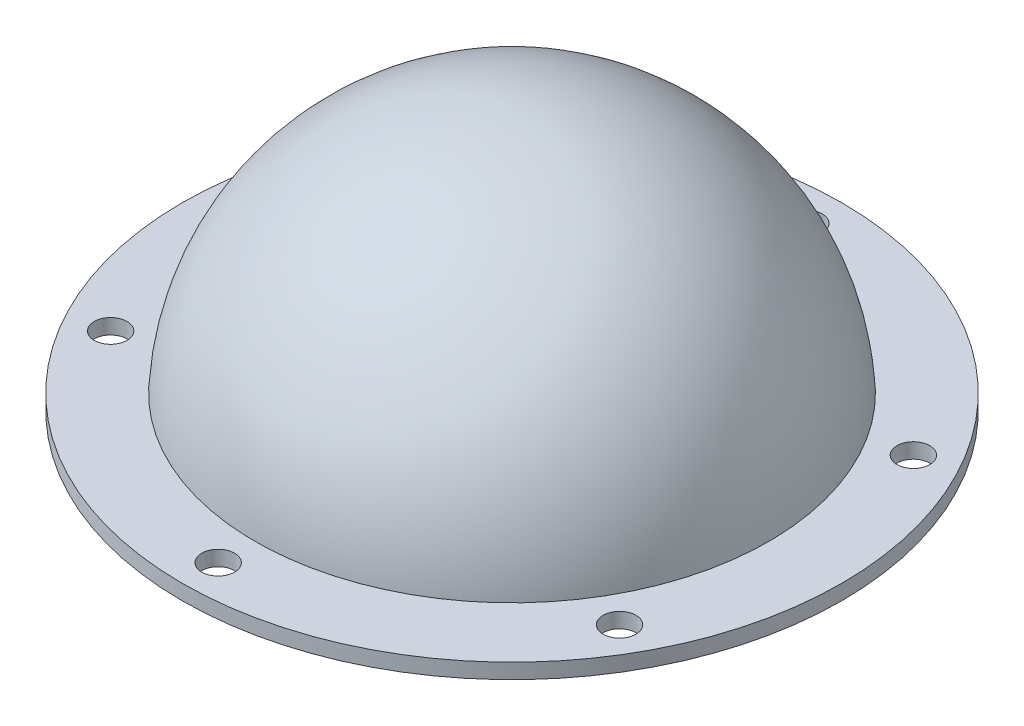
from build123d import *

# Parameters (mm, degrees)
SKETCH2_R          = 2.15
CUT_EXTRUDE1_DEPTH = 10


with BuildPart() as part:
    # Sketch1 → Revolve1 (revolve)
    with BuildSketch(Plane(origin=(0, 0, 0), x_dir=(0, 0, -1), z_dir=(1, 0, 0)), mode=Mode.PRIVATE) as revolve1_sk:
        with BuildLine():
            Line((-31.75, 0), (-43.200960454, 0))
            Line((-43.200960454, 0), (-43.200960454, 1.984375))
            Line((-43.200960454, 1.984375), (-33.675960454, 1.984375))
            ThreePointArc((-33.675960454, 1.984375), (-23.141590333, 24.545363178), (0, 33.734375))
            Line((0, 33.734375), (0, 31.75))
            ThreePointArc((0, 31.75), (-22.450640303, 22.450640303), (-31.75, 0))
        make_face()
    revolve(revolve1_sk.sketch.rotate(Axis((0, -1000, 0), (0, 1, 0)), 180), axis=Axis((0, -1000, 0), (0, 1, 0)))

    # Sketch2 → Cut-Extrude1 (cut)
    with BuildSketch(Plane(origin=(0, 1.984375, 0), x_dir=(1, 0, 0), z_dir=(0, 1, 0))):
        with Locations(Location((0, -38.5, 0), (0, 0, 270))):
            Circle(SKETCH2_R)
        with Locations(Location((-33.341978046, -19.25, 0), (0, 0, 270))):
            Circle(SKETCH2_R)
        with Locations(Location((-33.341978046, 19.25, 0), (0, 0, 270))):
            Circle(SKETCH2_R)
        with Locations(Location((0, 38.5, 0), (0, 0, 270))):
            Circle(SKETCH2_R)
        with Locations(Location((33.341978046, 19.25, 0), (0, 0, 270))):
            Circle(SKETCH2_R)
        with Locations(Location((33.341978046, -19.25, 0), (0, 0, 270))):
            Circle(SKETCH2_R)
    extrude(amount=-CUT_EXTRUDE1_DEPTH, mode=Mode.SUBTRACT)


solid = part.part
